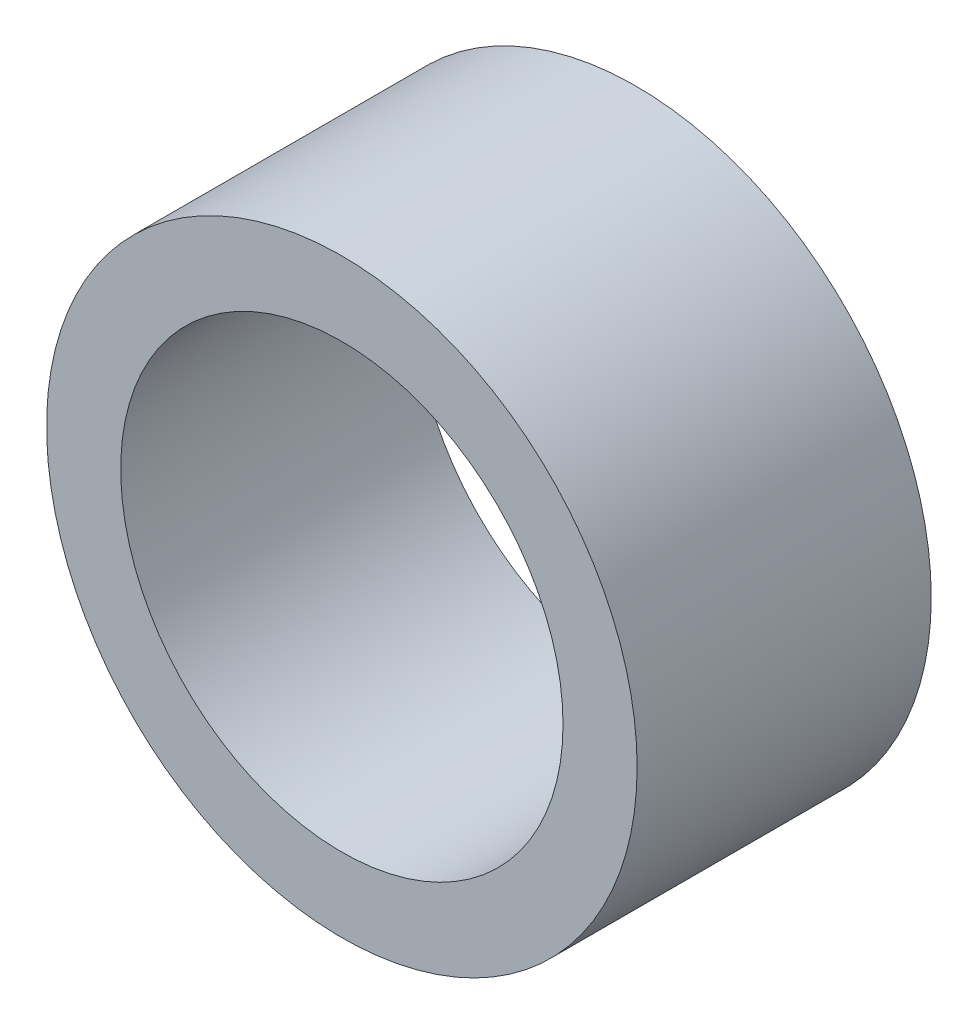
from build123d import *

# Parameters (mm, degrees)
SKETCH1_R           = 6.3754
SKETCH1_R_2         = 4.7752
BOSS_EXTRUDE1_DEPTH = 3.175


with BuildPart() as part:
    # Sketch1 → Boss-Extrude1 (new, symmetric)
    with BuildSketch(Plane.XY):
        Circle(SKETCH1_R)
        Circle(SKETCH1_R_2, mode=Mode.SUBTRACT)
    extrude(amount=BOSS_EXTRUDE1_DEPTH, both=True)


solid = part.part
